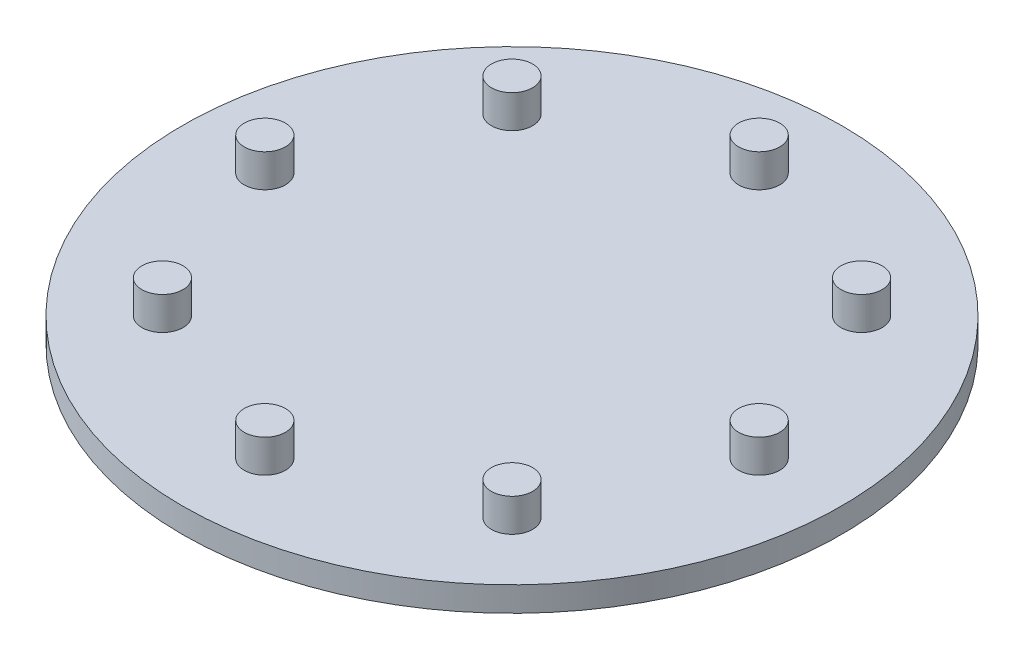
from build123d import *

# Parameters (mm, degrees)
SKETCH1_R           = 40
BOSS_EXTRUDE1_DEPTH = 3
SKETCH2_R           = 2.5
BOSS_EXTRUDE2_DEPTH = 4


with BuildPart() as part:
    # Sketch1 → Boss-Extrude1 (new body)
    with BuildSketch(Plane(origin=(0, 0, 0), x_dir=(1, 0, 0), z_dir=(0, 1, 0))):
        with Locations(Location((0, 0, 0), (0, 0, 270))):
            Circle(SKETCH1_R)
    extrude(amount=BOSS_EXTRUDE1_DEPTH)

    # Sketch2 → Boss-Extrude2 (add)
    with BuildSketch(Plane(origin=(0, 3, 0), x_dir=(1, 0, 0), z_dir=(0, 1, 0))):
        with Locations(Location((0, 30, 0), (0, 0, 270))):
            Circle(SKETCH2_R)
        with Locations(Location((21.213203436, 21.213203436, 0), (0, 0, 270))):
            Circle(SKETCH2_R)
        with Locations(Location((30, 0, 0), (0, 0, 270))):
            Circle(SKETCH2_R)
        with Locations(Location((21.213203436, -21.213203436, 0), (0, 0, 270))):
            Circle(SKETCH2_R)
        with Locations(Location((0, -30, 0), (0, 0, 270))):
            Circle(SKETCH2_R)
        with Locations(Location((-21.213203436, -21.213203436, 0), (0, 0, 270))):
            Circle(SKETCH2_R)
        with Locations(Location((-30, 0, 0), (0, 0, 270))):
            Circle(SKETCH2_R)
        with Locations(Location((-21.213203436, 21.213203436, 0), (0, 0, 270))):
            Circle(SKETCH2_R)
    extrude(amount=BOSS_EXTRUDE2_DEPTH)


solid = part.part
